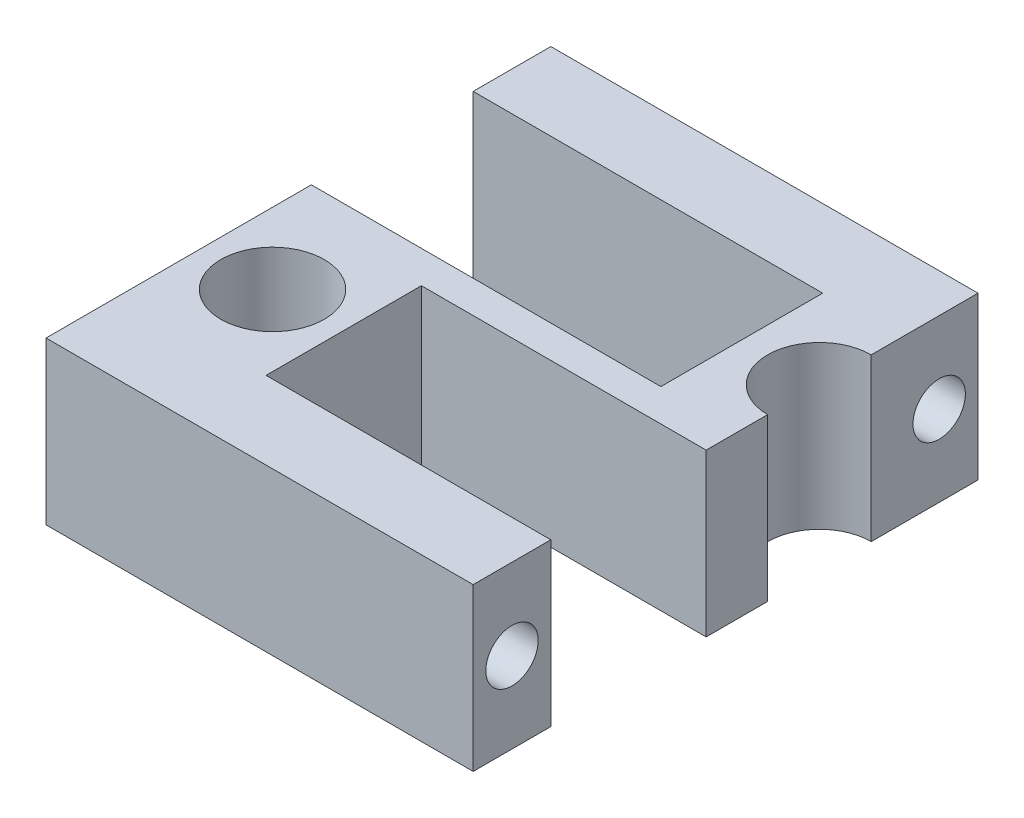
from build123d import *

# Parameters (mm, degrees)
SKETCH1_R           = 8
BOSS_EXTRUDE1_DEPTH = 25
SKETCH2_R           = 4.05
CUT_EXTRUDE1_DEPTH  = 76


with BuildPart() as part:
    # Sketch1 → Boss-Extrude1 (new body)
    with BuildSketch(Plane(origin=(0, 0, 0), x_dir=(1, 0, 0), z_dir=(0, 1, 0))):
        with BuildLine():
            Line((0, 0), (0, 24))
            Line((0, 24), (44, 24))
            Line((44, 24), (44, 33.5))
            ThreePointArc((44, 33.5), (36, 41.5), (44, 49.5))
            Line((44, 49.5), (44, 54))
            Line((44, 54), (44, 66))
            Line((44, 66), (-22, 66))
            Line((-22, 66), (-22, 54))
            Line((-22, 54), (32, 54))
            Line((32, 54), (32, 29))
            Line((32, 29), (-22, 29))
            Line((-22, 29), (-22, -12))
            Line((-22, -12), (44, -12))
            Line((44, -12), (44, 0))
            Line((44, 0), (0, 0))
        make_face()
        with Locations(Location((-11, 12, 0), (0, 0, 270))):
            Circle(SKETCH1_R, mode=Mode.SUBTRACT)
    extrude(amount=BOSS_EXTRUDE1_DEPTH)

    # Sketch2 → Cut-Extrude1 (cut)
    with BuildSketch(Plane(origin=(44, 0, 0), x_dir=(0, 0, -1), z_dir=(1, 0, 0))):
        with Locations((-6, 12.5)):
            Circle(SKETCH2_R)
        with Locations((60, 12.5)):
            Circle(SKETCH2_R)
    extrude(amount=-CUT_EXTRUDE1_DEPTH, mode=Mode.SUBTRACT)


solid = part.part
